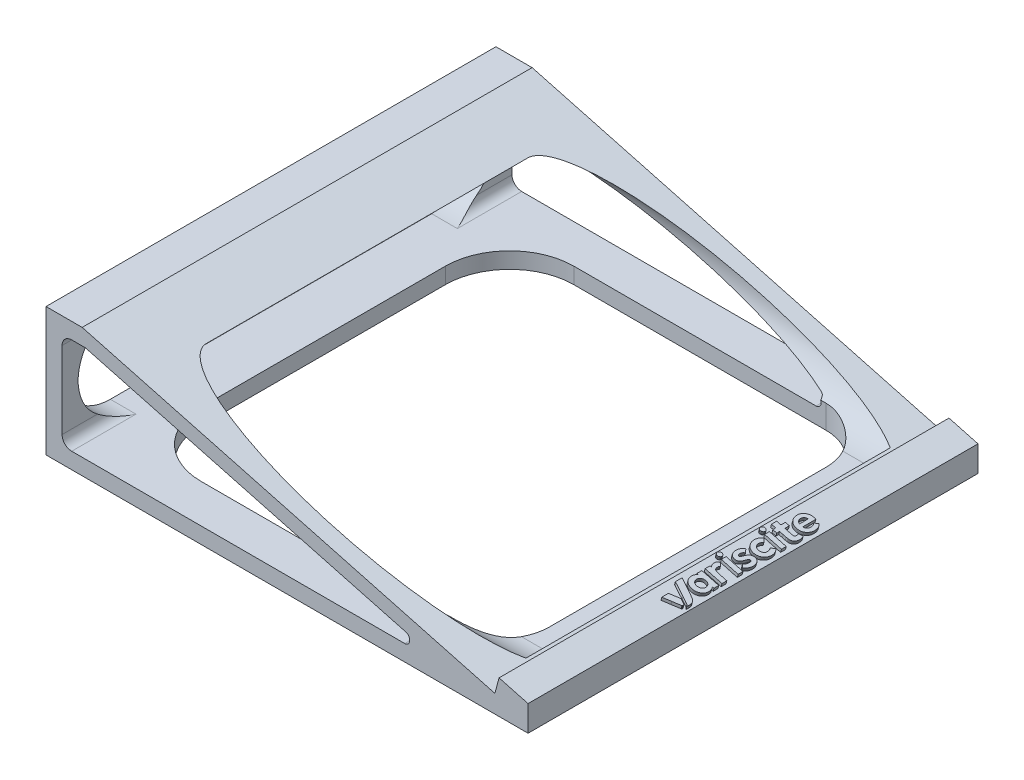
from build123d import *

# Parameters (mm, degrees)
AUFSATZ_LINEAR_AUSTRAGEN1_DEPTH = 140
SCHNITT_HINTEN_AUSTRAGEN_DEPTH  = 136
SCHNITT_BODEN_AUSTRAGEN_DEPTH   = 10
SCHNITT_SEITE_AUSTRAGEN_DEPTH   = 140
LOGO_AUSTRAGEN_DEPTH            = 1


with BuildPart() as part:
    # Basis → Aufsatz-Linear austragen1 (new body)
    with BuildSketch(Plane(origin=(0, 0, 0), x_dir=(0, 1, 0), z_dir=(0, 0, 1))):
        Polygon((0, 0), (0, 150), (40, 150), (40, 138.744142368), (5.590481338, 10.326070457), (10.420110469, 9.031975232), (8, 0), align=None)
    extrude(amount=AUFSATZ_LINEAR_AUSTRAGEN1_DEPTH)

    # Schnitt Hinten → Schnitt Hinten austragen (cut)
    with BuildSketch(Plane(origin=(-150, 0, 0), x_dir=(0, -1, 0), z_dir=(-1, 0, 0))):
        with BuildLine():
            Line((-5, 120), (-5, 20))
            ThreePointArc((-5, 20), (-20, 5), (-35, 20))
            Line((-35, 20), (-35, 120))
            ThreePointArc((-35, 120), (-20, 135), (-5, 120))
        make_face()
    extrude(amount=-SCHNITT_HINTEN_AUSTRAGEN_DEPTH, mode=Mode.SUBTRACT)

    # Schnitt Boden → Schnitt Boden austragen (cut)
    with BuildSketch(Plane(origin=(0.359069892, 0, 0), x_dir=(-1, 0, 0), z_dir=(0, 1, 0))):
        with BuildLine():
            Line((35.68514035, 128), (114.10321226, 128))
            ThreePointArc((114.10321226, 128), (128.245347884, 122.142135624), (134.10321226, 108))
            Line((134.10321226, 108), (134.10321226, 32))
            ThreePointArc((134.10321226, 32), (128.245347884, 17.857864376), (114.10321226, 12))
            Line((114.10321226, 12), (35.68514035, 12))
            ThreePointArc((35.68514035, 12), (25.078538632, 16.393398282), (20.68514035, 27))
            Line((20.68514035, 27), (20.68514035, 113))
            ThreePointArc((20.68514035, 113), (25.078538632, 123.606601718), (35.68514035, 128))
        make_face()
    extrude(amount=SCHNITT_BODEN_AUSTRAGEN_DEPTH, mode=Mode.SUBTRACT)

    # Schnitt Seite → Schnitt Seite austragen (cut)
    with BuildSketch(Plane.XY.offset(140)):
        with BuildLine():
            Line((-142, 35), (-137.763461174, 35))
            Line((-137.763461174, 35), (-37.972483895, 8.261088226))
            ThreePointArc((-37.972483895, 8.261088226), (-37.170682452, 7.72534163), (-36.860712462, 6.812199487))
            Line((-36.860712462, 6.812199487), (-36.860712462, 6.5))
            ThreePointArc((-36.860712462, 6.5), (-37.300052291, 5.439339828), (-38.360712462, 5))
            Line((-38.360712462, 5), (-142, 5))
            ThreePointArc((-142, 5), (-144.121320344, 5.878679656), (-145, 8))
            Line((-145, 8), (-145, 32))
            ThreePointArc((-145, 32), (-144.121320344, 34.121320344), (-142, 35))
        make_face()
    extrude(amount=-SCHNITT_SEITE_AUSTRAGEN_DEPTH, mode=Mode.SUBTRACT)

    # Skizze Logo → Logo austragen (add)
    # profile 1 of 12: a face of its own
    with BuildSketch(Plane(origin=(2, 7.464101615, 0), x_dir=(-0.9659258262890681, 0.25881904510252157, 0), z_dir=(0.25881904510252157, 0.9659258262890681, 0))):
        Polygon((8.765310954, 83.335963454), (8.722327205, 83.550293267), (8.6616974, 83.757364103), (8.584147923, 83.956513719), (8.49040509, 84.147079603), (8.381195148, 84.328399308), (8.257244616, 84.499810457), (8.119279742, 84.660650604), (7.968026842, 84.81025744), (7.804212233, 84.947968383), (7.628562364, 85.073121056), (7.441803485, 85.18505308), (7.244662045, 85.283102079), (7.037864227, 85.366605538), (6.82213648, 85.434901081), (6.59820512, 85.487326261), (6.366796532, 85.523218634), (6.105453465, 85.539483887), (5.809549458, 85.535778455), (5.520729813, 85.513920388), (5.280639966, 85.475727532), (5.078100426, 85.422709442), (4.883314977, 85.357432403), (4.696687144, 85.280301557), (4.518620651, 85.191722318), (4.349519091, 85.092099893), (4.189786121, 84.981839562), (4.039825334, 84.861346601), (3.900040388, 84.731026287), (3.770835009, 84.591283899), (3.652612721, 84.442524713), (3.545777182, 84.28515394), (3.450731985, 84.119576923), (3.367880854, 83.946198942), (3.297627448, 83.765425272), (3.240375225, 83.577661124), (3.196528045, 83.383311842), (3.168464425, 83.146600588), (3.159639711, 82.868815022), (3.169931355, 82.594553798), (3.199216675, 82.368415704), (3.273989911, 82.096535628), (3.382831198, 81.83759981), (3.525171772, 81.592756974), (3.700442802, 81.363155846), (3.787835009, 81.262034995), (3.523017375, 81.262034995), (3.258223616, 81.262034995), (3.258223616, 80.524447855), (3.258223616, 79.786860716), (5.970640838, 79.786860716), (8.68305806, 79.786860716), (8.68305806, 80.524447855), (8.68305806, 81.262034995), (8.418073904, 81.262034995), (8.153089816, 81.262034995), (8.25846962, 81.375052413), (8.411710126, 81.563509964), (8.540459104, 81.772754622), (8.644121622, 82.00048651), (8.722102613, 82.244405888), (8.773807008, 82.502213012), (8.798639874, 82.77160821), (8.796006212, 83.050291605), align=None)
        Polygon((7.409697141, 82.224705185), (7.364920837, 82.082588192), (7.305111097, 81.947105836), (7.231230092, 81.819432336), (7.144240127, 81.70074171), (7.045103375, 81.592208174), (6.934782073, 81.495005813), (6.814238528, 81.410308846), (6.684434844, 81.339291288), (6.503942015, 81.261565442), (6.342001097, 81.213303713), (6.172828585, 81.188842469), (5.970640838, 81.182518348), (5.801570438, 81.188760995), (5.645878304, 81.206620447), (5.501868465, 81.236747616), (5.367844743, 81.279793616), (5.242111098, 81.336409496), (5.122971422, 81.407246368), (5.008729539, 81.492955214), (4.897689476, 81.594187147), (4.801529006, 81.698470767), (4.719056579, 81.807107426), (4.64999014, 81.920796394), (4.59404743, 82.04023701), (4.550946394, 82.166128544), (4.520404708, 82.299170265), (4.502140316, 82.440061445), (4.495871028, 82.589501489), (4.504615617, 82.769270699), (4.531436224, 82.940729802), (4.575901404, 83.102976449), (4.637579979, 83.255108494), (4.716040504, 83.396223525), (4.8108516, 83.525419259), (4.921582023, 83.641793552), (5.047800328, 83.74444399), (5.146700955, 83.80874692), (5.251467752, 83.864777376), (5.477340787, 83.951649447), (5.72290117, 84.004317429), (5.985630503, 84.022038484), (6.238349235, 84.004307717), (6.474034785, 83.952218616), (6.690371493, 83.867426079), (6.885043702, 83.751584938), (7.055735751, 83.606349892), (7.200132051, 83.433375906), (7.315916942, 83.234317745), (7.400774699, 83.010830309), (7.431903966, 82.83742481), (7.444075237, 82.621524066), (7.436826916, 82.40374518), align=None, mode=Mode.SUBTRACT)
    # profile 2 of 12: a face of its own
    with BuildSketch(Plane(origin=(2, 7.464101615, 0), x_dir=(-0.9659258262890681, 0.25881904510252157, 0), z_dir=(0.25881904510252157, 0.9659258262890681, 0))):
        Polygon((8.765096816, 50.64212803), (8.720637706, 50.845958199), (8.662313376, 51.044818408), (8.590749244, 51.238006893), (8.506570659, 51.424822089), (8.410402973, 51.604562231), (8.302871536, 51.776525552), (8.184601767, 51.940010423), (8.056219015, 52.094315144), (7.918348699, 52.238738017), (7.771616103, 52.372577277), (7.616646711, 52.495131291), (7.454065739, 52.605698363), (7.28449874, 52.703576725), (7.10857093, 52.788064815), (6.926907727, 52.858460732), (6.74013455, 52.914062979), (6.435428018, 52.974977604), (6.128353963, 53.004662401), (5.822337851, 53.003646746), (5.520804879, 52.972460217), (5.227180583, 52.911632259), (4.944890227, 52.82169245), (4.677359278, 52.703170166), (4.428013001, 52.556594919), (4.193494993, 52.380639592), (3.980692473, 52.182419233), (3.79022162, 51.962920566), (3.622698746, 51.723130377), (3.478739962, 51.464035389), (3.358961514, 51.186622322), (3.26397958, 50.891878101), (3.194410405, 50.580789311), (3.164941904, 50.312773432), (3.155776323, 49.990216958), (3.166766495, 49.665532526), (3.197765257, 49.391132634), (3.244017326, 49.170586343), (3.30313798, 48.959049699), (3.374842061, 48.757114197), (3.458844344, 48.565371128), (3.554859537, 48.384411917), (3.662602414, 48.214827989), (3.78178775, 48.057210704), (3.91213032, 47.912151487), (4.079086723, 47.741768807), (4.504008284, 48.179157993), (4.928929893, 48.616547158), (4.797425244, 48.761851808), (4.703805161, 48.874889325), (4.622934958, 48.993440812), (4.554417252, 49.118579322), (4.497854789, 49.251377701), (4.452850252, 49.392908935), (4.419006185, 49.544245938), (4.395925407, 49.70646156), (4.383210529, 49.880628784), (4.38075971, 50.053981474), (4.38902834, 50.214742711), (4.408455013, 50.364532188), (4.439478324, 50.50496953), (4.482536869, 50.637674431), (4.538069311, 50.764266718), (4.60651411, 50.886365951), (4.688309928, 51.005591889), (4.834121697, 51.166226059), (5.010760378, 51.305093955), (5.206698328, 51.414508862), (5.410407702, 51.486784271), (5.47072328, 51.501916649), (5.47679057, 49.460180324), (5.482881601, 47.418420124), (5.578054135, 47.395126691), (5.781559758, 47.378525022), (6.137192773, 47.371309749), (6.565266909, 47.380535492), (6.69382495, 47.399328383), (6.832095013, 47.43355257), (7.017704089, 47.491123741), (7.196872027, 47.56095204), (7.369130623, 47.642527718), (7.534011808, 47.735340956), (7.69104738, 47.838882006), (7.839769201, 47.952641117), (7.979709069, 48.07610854), (8.110398981, 48.208774525), (8.231370667, 48.350129188), (8.342155991, 48.499662913), (8.442286816, 48.656865883), (8.531295074, 48.821228349), (8.608712494, 48.992240492), (8.674070939, 49.169392632), (8.726902341, 49.352174951), (8.766738496, 49.540077631), (8.791372197, 49.784069512), (8.799242901, 50.093065752), (8.790450965, 50.401080531), align=None)
        Polygon((7.560521831, 49.724236504), (7.527889618, 49.6061717), (7.480643072, 49.48989419), (7.42031731, 49.377452213), (7.348447651, 49.270894009), (7.26656928, 49.172267883), (7.176217382, 49.083622007), (7.07892714, 49.007004688), (6.976233807, 48.944464165), (6.842012337, 48.881415309), (6.710904737, 48.831179058), (6.607313846, 48.802008732), (6.555642633, 48.802157381), (6.545777377, 49.206509807), (6.541676043, 50.159056022), (6.541676043, 51.501988073), (6.607107194, 51.486760462), (6.847298815, 51.386591396), (6.959420023, 51.323065028), (7.067743333, 51.244213255), (7.170393636, 51.152258929), (7.265495892, 51.049424838), (7.351174927, 50.937933702), (7.425555632, 50.820008442), (7.486762969, 50.697871777), (7.532921761, 50.573746563), (7.574875759, 50.379894216), (7.593903562, 50.160091034), (7.589340499, 49.934738068), align=None, mode=Mode.SUBTRACT)
    # profile 3 of 12: a face of its own
    with BuildSketch(Plane(origin=(2, 7.464101615, 0), x_dir=(-0.9659258262890681, 0.25881904510252157, 0), z_dir=(0.25881904510252157, 0.9659258262890681, 0))):
        Polygon((8.799668209, 69.533090856), (8.749794071, 69.792686556), (8.669757692, 70.053161201), (8.565488033, 70.298253515), (8.442913988, 70.511702429), (8.320901085, 70.672384687), (8.186306508, 70.811589268), (8.039097817, 70.929332562), (7.879242704, 71.025631159), (7.706708865, 71.100501381), (7.521463925, 71.153959819), (7.323475443, 71.186022729), (7.112711248, 71.196706768), (6.851085856, 71.18158916), (6.617687638, 71.134685505), (6.510637287, 71.098586818), (6.409519875, 71.053669149), (6.313960881, 70.999641677), (6.223585646, 70.936213577), (6.138019582, 70.863094094), (6.056888165, 70.779992337), (5.906430578, 70.582678845), (5.769216165, 70.341946584), (5.642248006, 70.055469103), (5.552301048, 69.786160572), (5.435319142, 69.389261364), (5.298738713, 68.941351569), (5.237440798, 68.779979213), (5.17740451, 68.654145749), (5.116080089, 68.559213994), (5.050917639, 68.490546762), (4.979367265, 68.443506935), (4.898879139, 68.413457395), (4.822031361, 68.400866953), (4.748660847, 68.404840142), (4.67967062, 68.424742707), (4.615963904, 68.459940261), (4.558443789, 68.509798415), (4.508013364, 68.573682915), (4.465575718, 68.650959442), (4.432034076, 68.740993675), (4.400719334, 68.916093259), (4.39337025, 69.18701973), (4.401582294, 69.380558456), (4.423479681, 69.564484441), (4.459317289, 69.739521369), (4.509349855, 69.906393195), (4.573832324, 70.065823741), (4.653019502, 70.218536826), (4.747166197, 70.365256271), (4.856527351, 70.506705896), (5.001594122, 70.679039559), (4.564133522, 71.11830836), (4.12667299, 71.557553422), (3.948224488, 71.367731794), (3.824588857, 71.225179308), (3.710341848, 71.071096953), (3.605733885, 70.906562098), (3.511015256, 70.732652177), (3.426436453, 70.550444692), (3.352247763, 70.361017079), (3.288699678, 70.16544684), (3.236042487, 69.964811342), (3.194526613, 69.760188087), (3.164402479, 69.55265451), (3.145920374, 69.343288046), (3.139330789, 69.133166198), (3.14488408, 68.923366399), (3.162830604, 68.714966086), (3.193420783, 68.50904276), (3.236904974, 68.306673789), (3.305610583, 68.099756795), (3.404027966, 67.869570109), (3.472677798, 67.735540452), (3.537227847, 67.632293125), (3.6136893, 67.537307953), (3.71807348, 67.428064761), (3.832174943, 67.321463594), (3.946325101, 67.231111493), (4.062975312, 67.155941545), (4.18457653, 67.0948865), (4.313580114, 67.046879443), (4.452437016, 67.010853259), (4.603598595, 66.9857409), (4.769515871, 66.970475183), (5.016357171, 66.970364236), (5.245680426, 67.001601078), (5.457807888, 67.064376445), (5.653062012, 67.158881138), (5.831764984, 67.285305758), (5.99423919, 67.443841105), (6.140806884, 67.63467778), (6.271790519, 67.858006653), (6.355220801, 68.047287371), (6.450908211, 68.311697097), (6.554416145, 68.638068668), (6.661307933, 69.013234649), (6.7369359, 69.25498931), (6.820085475, 69.454745999), (6.906348922, 69.603439696), (6.949271026, 69.655805053), (6.991318704, 69.692005177), (7.086514642, 69.735408704), (7.189345967, 69.748326524), (7.288746632, 69.731001776), (7.373650521, 69.683677601), (7.432166597, 69.622381169), (7.481540496, 69.545442812), (7.521434316, 69.454345173), (7.55151016, 69.350570764), (7.571430058, 69.235602025), (7.580856045, 69.110921468), (7.579450153, 68.978011669), (7.566874549, 68.838355138), (7.514904083, 68.577168274), (7.476006763, 68.455632477), (7.428223085, 68.339532078), (7.371344035, 68.228414925), (7.305160871, 68.121828663), (7.14404683, 67.920439871), (7.020750784, 67.787745559), (7.450978239, 67.340268086), (7.881205693, 66.892814422), (7.945899197, 66.938877914), (8.045531468, 67.026343704), (8.167889151, 67.156846793), (8.291049833, 67.305462456), (8.393091175, 67.44726583), (8.535574463, 67.704781862), (8.654027481, 67.995846214), (8.74401349, 68.307619571), (8.801095819, 68.627262486), (8.81702007, 68.835134164), (8.822045671, 69.082585707), (8.816239393, 69.328832749), align=None)
    # profile 4 of 12: a face of its own
    with BuildSketch(Plane(origin=(2, 7.464101615, 0), x_dir=(-0.9659258262890681, 0.25881904510252157, 0), z_dir=(0.25881904510252157, 0.9659258262890681, 0))):
        Polygon((9.361162366, 56.826486862), (8.68305806, 56.826486862), (8.68305806, 57.266659832), (8.68305806, 57.706832802), (8.052540022, 57.706832802), (7.422021983, 57.706832802), (7.422021983, 57.266659832), (7.422021983, 56.826486862), (6.238313624, 56.826463054), (5.327619497, 56.819369722), (4.800304204, 56.802336809), (4.572265575, 56.770461127), (4.351351573, 56.719694353), (4.145088122, 56.652122226), (3.961001416, 56.56983035), (3.799116612, 56.463379113), (3.628599447, 56.315398446), (3.472839936, 56.148466593), (3.355228228, 55.985161666), (3.286422396, 55.85618189), (3.226692106, 55.718211621), (3.176067709, 55.571381431), (3.134579622, 55.415821693), (3.102258195, 55.251663046), (3.079133847, 55.079035862), (3.060597854, 54.708897978), (3.068856636, 54.437209783), (3.094940271, 54.196801325), (3.14080932, 53.975063077), (3.208424611, 53.759385374), (3.323535794, 53.504450869), (3.37843695, 53.412504907), (3.414235169, 53.3764825), (3.919529987, 53.565614097), (4.478716174, 53.779585777), (4.545265564, 53.804425793), (4.486544118, 53.905713166), (4.422285971, 54.038540952), (4.379947941, 54.179432334), (4.358519634, 54.333069416), (4.35699052, 54.504134302), (4.377690555, 54.705189241), (4.400480646, 54.776374198), (4.4370068, 54.851656779), (4.512137023, 54.959899896), (4.609289946, 55.049223055), (4.724336786, 55.116579223), (4.853148758, 55.158921299), (5.258018623, 55.178104495), (6.197841462, 55.184760648), (7.422021983, 55.184760648), (7.422021983, 54.482863209), (7.422021983, 53.78096577), (8.052540022, 53.78096577), (8.68305806, 53.78096577), (8.68305806, 54.482863209), (8.68305806, 55.184760648), (9.361162366, 55.184760648), (10.039266671, 55.184760648), (10.039266671, 56.005623755), (10.039266671, 56.826486862), align=None)
    # profile 5 of 12: a face of its own
    with BuildSketch(Plane(origin=(2, 7.464101615, 0), x_dir=(-0.9659258262890681, 0.25881904510252157, 0), z_dir=(0.25881904510252157, 0.9659258262890681, 0))):
        Polygon((8.801095819, 63.67869518), (8.770971415, 63.900628547), (8.726824104, 64.116606717), (8.669080341, 64.326071111), (8.598166379, 64.528462879), (8.51450874, 64.723223305), (8.418533745, 64.909793676), (8.310667781, 65.087615275), (8.191337235, 65.256129389), (8.060968631, 65.414777235), (7.919988221, 65.56300003), (7.768822393, 65.700239195), (7.60789767, 65.82593588), (7.437640304, 65.939531369), (7.258476817, 66.040467017), (7.07083353, 66.128183971), (6.875136832, 66.202123519), (6.617812479, 66.274103518), (6.353238119, 66.320831546), (6.084462471, 66.342484851), (5.81453412, 66.339240406), (5.546501717, 66.311275256), (5.283414116, 66.258766444), (5.028319834, 66.18189108), (4.78426759, 66.080826141), (4.503711583, 65.927655846), (4.246402608, 65.746894383), (4.013295213, 65.539738634), (3.805343747, 65.307385747), (3.623502624, 65.051032603), (3.468726327, 64.771876283), (3.341969203, 64.471113737), (3.244185669, 64.149941978), (3.192679832, 63.85054108), (3.166515937, 63.49446495), (3.167534223, 63.134230968), (3.197574927, 62.822356511), (3.241451985, 62.606867789), (3.299892456, 62.398082904), (3.372882579, 62.196029441), (3.460408732, 62.000734984), (3.56245729, 61.812227187), (3.679014495, 61.630533567), (3.810066722, 61.455681775), (3.955600348, 61.287699398), (4.066048109, 61.168733731), (4.538103843, 61.655446086), (5.010135836, 62.142158441), (4.913392979, 62.244564053), (4.817120348, 62.361099473), (4.726613866, 62.497815197), (4.649129676, 62.642556613), (4.591923922, 62.783169245), (4.558062455, 62.907270921), (4.533787292, 63.043817425), (4.514028182, 63.336731323), (4.532711341, 63.626883749), (4.556489029, 63.759978415), (4.589901514, 63.879247518), (4.650913867, 64.026497419), (4.728825929, 64.164928675), (4.82235105, 64.293295442), (4.930202783, 64.410351875), (5.051094682, 64.514852263), (5.183740231, 64.605550762), (5.326852849, 64.681201593), (5.479146089, 64.740558912), (5.589265527, 64.77289086), (5.690027571, 64.79233871), (5.958744271, 64.805466621), (6.129690252, 64.801673376), (6.282955105, 64.787081233), (6.421698092, 64.760485015), (6.549078678, 64.72067975), (6.66825619, 64.666460328), (6.782390026, 64.596621643), (6.894639582, 64.509958585), (7.008164187, 64.405266113), (7.120671114, 64.283362875), (7.21546899, 64.157521589), (7.293016984, 64.026507468), (7.353774327, 63.889085932), (7.398200388, 63.744022398), (7.426754199, 63.590082082), (7.439895127, 63.426030471), (7.438082338, 63.250632914), (7.424775361, 63.101701541), (7.400337857, 62.956973951), (7.365243157, 62.8176651), (7.31996432, 62.684989807), (7.264974542, 62.560162894), (7.200746948, 62.444399248), (7.127754801, 62.338913622), (7.046471161, 62.244920972), (6.959412065, 62.155244604), (7.434584773, 61.678739519), (7.909781221, 61.202234434), (8.071574502, 61.370975366), (8.260884626, 61.595796663), (8.42474793, 61.846983785), (8.561870685, 62.120445718), (8.670959226, 62.412091513), (8.750719754, 62.717830291), (8.799858539, 63.033571104), (8.817081782, 63.355223072), align=None)
    # profile 6 of 12: a face of its own
    with BuildSketch(Plane(origin=(2, 7.464101615, 0), x_dir=(-0.9659258262890681, 0.25881904510252157, 0), z_dir=(0.25881904510252157, 0.9659258262890681, 0))):
        Polygon((9.212455315, 87.293237425), (5.408989063, 88.831311844), (3.905364501, 89.449679385), (3.224389802, 89.739909171), (3.091562016, 89.823666966), (2.959307513, 89.930105523), (2.841734856, 90.046635345), (2.752952606, 90.160666934), (2.684214287, 90.267736035), (2.693041496, 89.577735163), (2.703091147, 89.122245015), (2.728415958, 88.835921781), (2.751387678, 88.728158333), (2.783675517, 88.629039386), (2.883529346, 88.41187162), (2.95330153, 88.285379084), (3.033104482, 88.162330359), (3.217903205, 87.931907615), (3.428126289, 87.73129026), (3.539709825, 87.645498187), (3.653974774, 87.57116503), (4.601606267, 87.1596929), (6.578519728, 86.322551928), (8.570547762, 85.48712858), (9.563522974, 85.080809118), (9.579040599, 85.078374823), (9.590744138, 85.089953522), (9.604860591, 85.201306463), (9.610990268, 86.099892853), (9.610990268, 87.134037609), align=None)
    # profile 7 of 12: a face of its own
    with BuildSketch(Plane(origin=(2, 7.464101615, 0), x_dir=(-0.9659258262890681, 0.25881904510252157, 0), z_dir=(0.25881904510252157, 0.9659258262890681, 0))):
        Polygon((8.764739896, 76.245633471), (8.701672492, 76.49922737), (8.607657653, 76.73037697), (8.481200862, 76.942084519), (8.320807606, 77.137352537), (8.200295356, 77.264788562), (8.441676708, 77.264788562), (8.68305806, 77.264788562), (8.68305806, 78.014272268), (8.68305806, 78.763755974), (5.970640838, 78.763755974), (3.258223616, 78.763755974), (3.258223616, 78.014272268), (3.258223616, 77.264788562), (4.834518746, 77.264598232), (6.022316569, 77.257867755), (6.56040122, 77.240162685), (6.780410042, 77.188005126), (6.967260849, 77.107010353), (7.049807196, 77.054826221), (7.12593021, 76.994385533), (7.261394558, 76.847338035), (7.358683181, 76.701388745), (7.41822105, 76.55719269), (7.448216768, 76.385836779), (7.45687894, 76.158407853), (7.455711196, 75.984219451), (7.447679905, 75.873797387), (7.427759467, 75.792663137), (7.390924348, 75.706338316), (7.326736411, 75.587699824), (7.266153144, 75.502930826), (7.208145536, 75.442282137), (7.736876501, 74.970250143), (8.265583725, 74.498194342), (8.373200075, 74.618563811), (8.498768479, 74.779120622), (8.60330313, 74.955487634), (8.686374267, 75.14587789), (8.747552332, 75.348504434), (8.786407566, 75.561580308), (8.802510344, 75.783318422), (8.795431041, 76.011931817), align=None)
    # profile 8 of 12: a face of its own
    with BuildSketch(Plane(origin=(2, 7.464101615, 0), x_dir=(-0.9659258262890681, 0.25881904510252157, 0), z_dir=(0.25881904510252157, 0.9659258262890681, 0))):
        Polygon((5.970640838, 60.276491223), (3.258223616, 60.276491223), (3.258223616, 59.527007517), (3.258223616, 58.777523811), (5.970640838, 58.777523811), (8.68305806, 58.777523811), (8.68305806, 59.527007517), (8.68305806, 60.276491223), align=None)
    # profile 9 of 12: a face of its own
    with BuildSketch(Plane(origin=(2, 7.464101615, 0), x_dir=(-0.9659258262890681, 0.25881904510252157, 0), z_dir=(0.25881904510252157, 0.9659258262890681, 0))):
        Polygon((5.970640838, 73.7434048), (3.258223616, 73.7434048), (3.258223616, 72.993921094), (3.258223616, 72.244437388), (5.970640838, 72.244437388), (8.68305806, 72.244437388), (8.68305806, 72.993921094), (8.68305806, 73.7434048), align=None)
    # profile 10 of 12: a face of its own
    with BuildSketch(Plane(origin=(2, 7.464101615, 0), x_dir=(-0.9659258262890681, 0.25881904510252157, 0), z_dir=(0.25881904510252157, 0.9659258262890681, 0))):
        Polygon((7.907687456, 92.992049824), (5.703774088, 92.011183833), (3.477286993, 91.002943848), (3.417962386, 90.951235608), (3.373733736, 90.886300988), (3.344865497, 90.812131655), (3.331622457, 90.732719278), (3.334269136, 90.652055525), (3.353070121, 90.574132133), (3.388290066, 90.502940634), (3.440193492, 90.442472833), (3.719468042, 90.304854829), (4.287809019, 90.046543148), (4.856091993, 89.796779183), (5.135192535, 89.684804264), (6.349635743, 90.217809087), (7.834999419, 90.889521962), (7.921677788, 90.930850676), (7.921677788, 91.96145025), (7.917564583, 92.689308979), align=None)
    # profile 11 of 12: a face of its own
    with BuildSketch(Plane(origin=(2, 7.464101615, 0), x_dir=(-0.9659258262890681, 0.25881904510252157, 0), z_dir=(0.25881904510252157, 0.9659258262890681, 0))):
        Polygon((10.752751374, 73.140391599), (10.700016891, 73.300691916), (10.612235054, 73.443878994), (10.491984558, 73.5666605), (10.341843962, 73.665744039), (10.270234439, 73.69958453), (10.203900266, 73.719332107), (10.015473538, 73.730842011), (9.827216299, 73.719358882), (9.761030505, 73.699715037), (9.689816952, 73.66610089), (9.593733707, 73.608296225), (9.509785785, 73.542211531), (9.438181522, 73.468183698), (9.379129123, 73.386549411), (9.332836992, 73.297645625), (9.299513264, 73.201809162), (9.279366278, 73.099376707), (9.272604304, 72.990685215), (9.275342371, 72.893507741), (9.286157456, 72.817527711), (9.308950919, 72.745594047), (9.347624052, 72.66055547), (9.422211476, 72.53641852), (9.513262915, 72.433967517), (9.621289331, 72.352725154), (9.746801486, 72.292213985), (9.844108994, 72.263492506), (9.944532463, 72.248318244), (10.046242379, 72.246375489), (10.14740943, 72.257348126), (10.246204236, 72.280920377), (10.340797417, 72.316776329), (10.429359594, 72.364600003), (10.510061385, 72.424075553), (10.574965655, 72.489973154), (10.631957339, 72.568421808), (10.680054502, 72.656523402), (10.718275146, 72.751379821), (10.745637134, 72.850093019), (10.761158536, 72.949764745), (10.763857283, 73.047497022), align=None)
    # profile 12 of 12: a face of its own
    with BuildSketch(Plane(origin=(2, 7.464101615, 0), x_dir=(-0.9659258262890681, 0.25881904510252157, 0), z_dir=(0.25881904510252157, 0.9659258262890681, 0))):
        Polygon((10.752751374, 59.673478022), (10.699903111, 59.834022963), (10.611985237, 59.977316334), (10.491723613, 60.099874058), (10.341843962, 60.198211788), (10.27032812, 60.23161065), (10.203793231, 60.251175315), (10.015473538, 60.262667414), (9.828352411, 60.251389453), (9.762924295, 60.232514076), (9.694266235, 60.200567307), (9.538567695, 60.098560565), (9.473912162, 60.038842415), (9.417992248, 59.973232872), (9.370762833, 59.901670965), (9.332178593, 59.824095657), (9.280765358, 59.650660414), (9.268516728, 59.532259194), (9.275132347, 59.415879438), (9.299753436, 59.30329731), (9.34152115, 59.19628891), (9.399576779, 59.096630335), (9.473061477, 59.006097751), (9.561116534, 58.926467257), (9.662883104, 58.85951495), (9.737635905, 58.821651495), (9.805219565, 58.800546655), (9.889782586, 58.791402251), (10.015473538, 58.789420378), (10.14116449, 58.791402251), (10.225727511, 58.800546655), (10.293311171, 58.821651495), (10.368063971, 58.85951495), (10.478966784, 58.93355027), (10.567902539, 59.013099628), (10.62122022, 59.08236213), (10.666968946, 59.159221779), (10.7336336, 59.328129637), (10.763644898, 59.504617039), (10.763576981, 59.590951235), align=None)
    extrude(amount=LOGO_AUSTRAGEN_DEPTH)


solid = part.part
